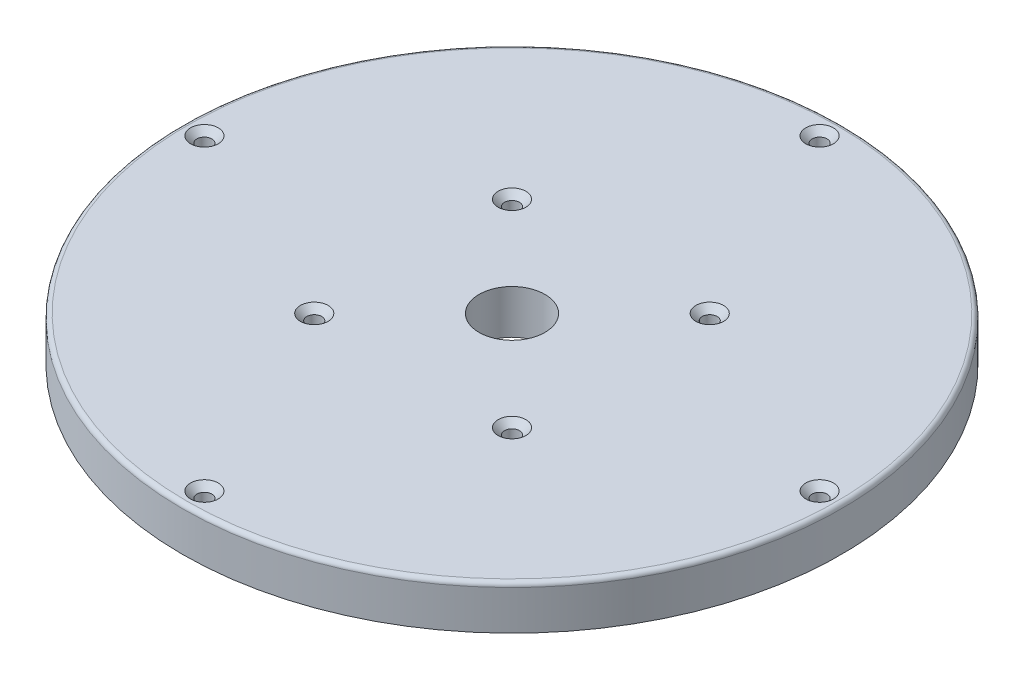
from build123d import *

# Parameters (mm, degrees)
SKETCH1_R                                       = 75
BOSS_EXTRUDE1_DEPTH                             = 10
CSK_FOR_M3_FLAT_HEAD_MACHINE_SCREW1_D           = 3.4
CSK_FOR_M3_FLAT_HEAD_MACHINE_SCREW1_CSINK_D     = 6.3
CSK_FOR_M3_FLAT_HEAD_MACHINE_SCREW1_CSINK_ANGLE = 90
CIRPATTERN1_COUNT                               = 4
SKETCH8_R                                       = 7.5
CUT_EXTRUDE1_DEPTH                              = 107.536378763
CSK_FOR_M3_FLAT_HEAD_MACHINE_SCREW2_D           = 3.4
CSK_FOR_M3_FLAT_HEAD_MACHINE_SCREW2_CSINK_D     = 6.3
CSK_FOR_M3_FLAT_HEAD_MACHINE_SCREW2_CSINK_ANGLE = 90
FILLET1_R                                       = 1


with BuildPart() as part:
    # Sketch1 → Boss-Extrude1 (new body)
    with BuildSketch(Plane(origin=(0, 0, 0), x_dir=(1, 0, 0), z_dir=(0, 1, 0))):
        with Locations(Location((0, 0, 0), (0, 0, 270))):
            Circle(SKETCH1_R)
    extrude(amount=BOSS_EXTRUDE1_DEPTH)

    # CSK for M3 Flat Head Machine Screw1 (through all)
    with Locations(Plane(origin=(0, 10, 0), x_dir=(1, 0, 0), z_dir=(0, 1, 0))):
        with Locations((0, 70)):
            csk_for_m3_flat_head_machine_screw1 = CounterSinkHole(CSK_FOR_M3_FLAT_HEAD_MACHINE_SCREW1_D / 2, CSK_FOR_M3_FLAT_HEAD_MACHINE_SCREW1_CSINK_D / 2, counter_sink_angle=CSK_FOR_M3_FLAT_HEAD_MACHINE_SCREW1_CSINK_ANGLE)

    # CirPattern1: CSK for M3 Flat Head Machine Screw1 ×4 about axis
    cirpattern1_axis = Axis((0, 0, 0), (0, 1, 0))
    for i in range(1, CIRPATTERN1_COUNT):
        add(csk_for_m3_flat_head_machine_screw1.rotate(cirpattern1_axis, i * 360 / CIRPATTERN1_COUNT), mode=Mode.SUBTRACT)

    # Sketch8 → Cut-Extrude1 (cut, through all)
    with BuildSketch(Plane(origin=(0, 10, 0), x_dir=(1, 0, 0), z_dir=(0, 1, 0))):
        with Locations(Location((0, 0, 0), (0, 0, 270))):
            Circle(SKETCH8_R)
    extrude(amount=-CUT_EXTRUDE1_DEPTH, mode=Mode.SUBTRACT)

    # CSK for M3 Flat Head Machine Screw2 (through all)
    with Locations(Plane(origin=(0, 10, 0), x_dir=(1, 0, 0), z_dir=(0, 1, 0))):
        with Locations((22.5, 22.5), (22.5, -22.5), (-22.5, -22.5), (-22.5, 22.5)):
            CounterSinkHole(CSK_FOR_M3_FLAT_HEAD_MACHINE_SCREW2_D / 2, CSK_FOR_M3_FLAT_HEAD_MACHINE_SCREW2_CSINK_D / 2, counter_sink_angle=CSK_FOR_M3_FLAT_HEAD_MACHINE_SCREW2_CSINK_ANGLE)

    # Fillet1
    fillet1_edges = [part.edges().sort_by_distance(p)[0] for p in [
        (0, 10, -75),
    ]]
    fillet(fillet1_edges, radius=FILLET1_R)


solid = part.part
